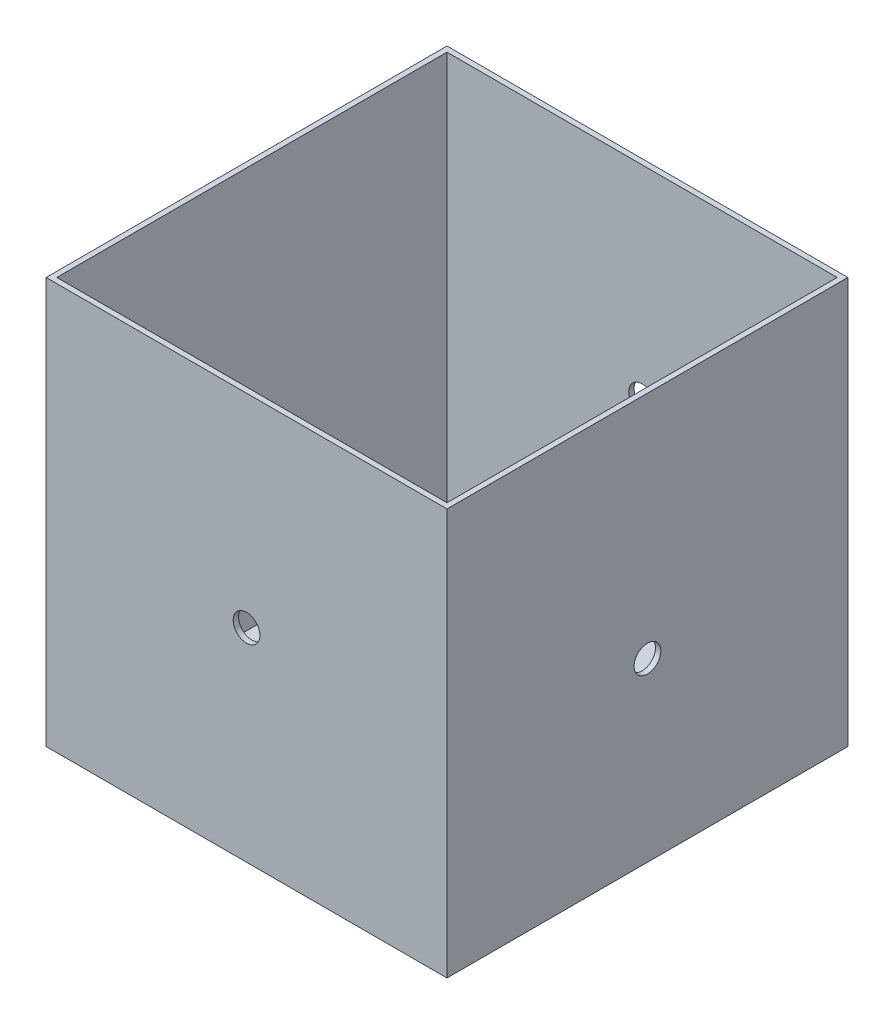
from build123d import *

# Parameters (mm, degrees)
SKETCH1_W           = 150
SKETCH1_H           = 150
BOSS_EXTRUDE1_DEPTH = 0.5
SKETCH2_W           = 150
SKETCH2_H           = 150
SKETCH2_W_2         = 146
SKETCH2_H_2         = 146
BOSS_EXTRUDE2_DEPTH = 15
SKETCH6_W           = 150
SKETCH6_H           = 150
SKETCH6_W_2         = 146
SKETCH6_H_2         = 146
BOSS_EXTRUDE4_DEPTH = 135
SKETCH7_W           = 150
SKETCH7_H           = 150
BOSS_EXTRUDE5_DEPTH = 1.5
SKETCH8_R           = 5
CUT_EXTRUDE1_DEPTH  = 226.333641519
SKETCH9_R           = 5
CUT_EXTRUDE2_DEPTH  = 226.333641519


with BuildPart() as part:
    # Sketch1 → Boss-Extrude1 (new body)
    with BuildSketch(Plane(origin=(0, 0, 0), x_dir=(1, 0, 0), z_dir=(0, 1, 0))):
        Rectangle(SKETCH1_W, SKETCH1_H)
    extrude(amount=BOSS_EXTRUDE1_DEPTH)

    # Sketch2 → Boss-Extrude2 (add)
    with BuildSketch(Plane(origin=(0, 0.5, 0), x_dir=(1, 0, 0), z_dir=(0, 1, 0))):
        Rectangle(SKETCH2_W, SKETCH2_H)
        Rectangle(SKETCH2_W_2, SKETCH2_H_2, mode=Mode.SUBTRACT)
    extrude(amount=BOSS_EXTRUDE2_DEPTH)

    # Sketch6 → Boss-Extrude4 (add)
    with BuildSketch(Plane(origin=(0, 15.5, 0), x_dir=(1, 0, 0), z_dir=(0, 1, 0))):
        Rectangle(SKETCH6_W, SKETCH6_H)
        Rectangle(SKETCH6_W_2, SKETCH6_H_2, mode=Mode.SUBTRACT)
    extrude(amount=BOSS_EXTRUDE4_DEPTH)

    # Sketch7 → Boss-Extrude5 (add)
    with BuildSketch(Plane.XZ):
        Rectangle(SKETCH7_W, SKETCH7_H)
    extrude(amount=BOSS_EXTRUDE5_DEPTH)

    # Sketch8 → Cut-Extrude1 (cut, through all)
    with BuildSketch(Plane(origin=(0, 0, -75), x_dir=(-1, 0, 0), z_dir=(0, 0, -1))):
        with Locations((0, 74.5)):
            Circle(SKETCH8_R)
    extrude(amount=-CUT_EXTRUDE1_DEPTH, mode=Mode.SUBTRACT)

    # Sketch9 → Cut-Extrude2 (cut, through all)
    with BuildSketch(Plane.ZY.offset(75)):
        with Locations((0, 64.5)):
            Circle(SKETCH9_R)
    extrude(amount=-CUT_EXTRUDE2_DEPTH, mode=Mode.SUBTRACT)


solid = part.part
